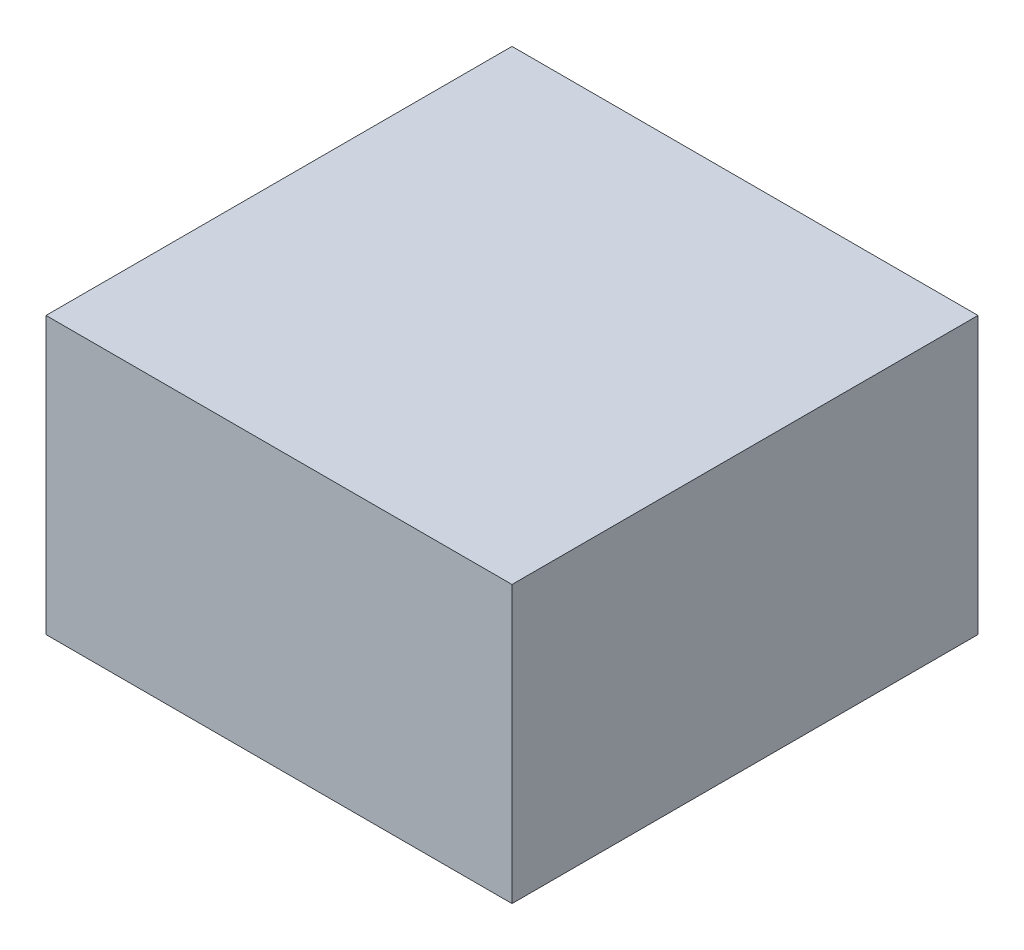
from build123d import *

# Parameters (mm, degrees)
SKETCH_1_W          = 43.5
SKETCH_1_H          = 43.5
EXTRUDE_1_DEPTH     = 25.8
SKETCH_2_R          = 1.5
CUT_EXTRUDE_1_DEPTH = 10


with BuildPart() as part:
    # Эскиз1 → Бобышка-Вытянуть1 (new body)
    with BuildSketch(Plane(origin=(0, 0, 0), x_dir=(1, 0, 0), z_dir=(0, 1, 0))):
        Rectangle(SKETCH_1_W, SKETCH_1_H)
    extrude(amount=EXTRUDE_1_DEPTH)

    # Эскиз2 → Вырез-Вытянуть1 (cut)
    with BuildSketch(Plane.XZ):
        with Locations(Location((-18.5, 18.5, 0), (0, 0, 270))):
            Circle(SKETCH_2_R)
        with Locations(Location((18.5, 18.5, 0), (0, 0, 270))):
            Circle(SKETCH_2_R)
        with Locations(Location((-18.5, -18.5, 0), (0, 0, 270))):
            Circle(SKETCH_2_R)
        with Locations(Location((18.5, -18.5, 0), (0, 0, 270))):
            Circle(SKETCH_2_R)
    extrude(amount=-CUT_EXTRUDE_1_DEPTH, mode=Mode.SUBTRACT)


solid = part.part
